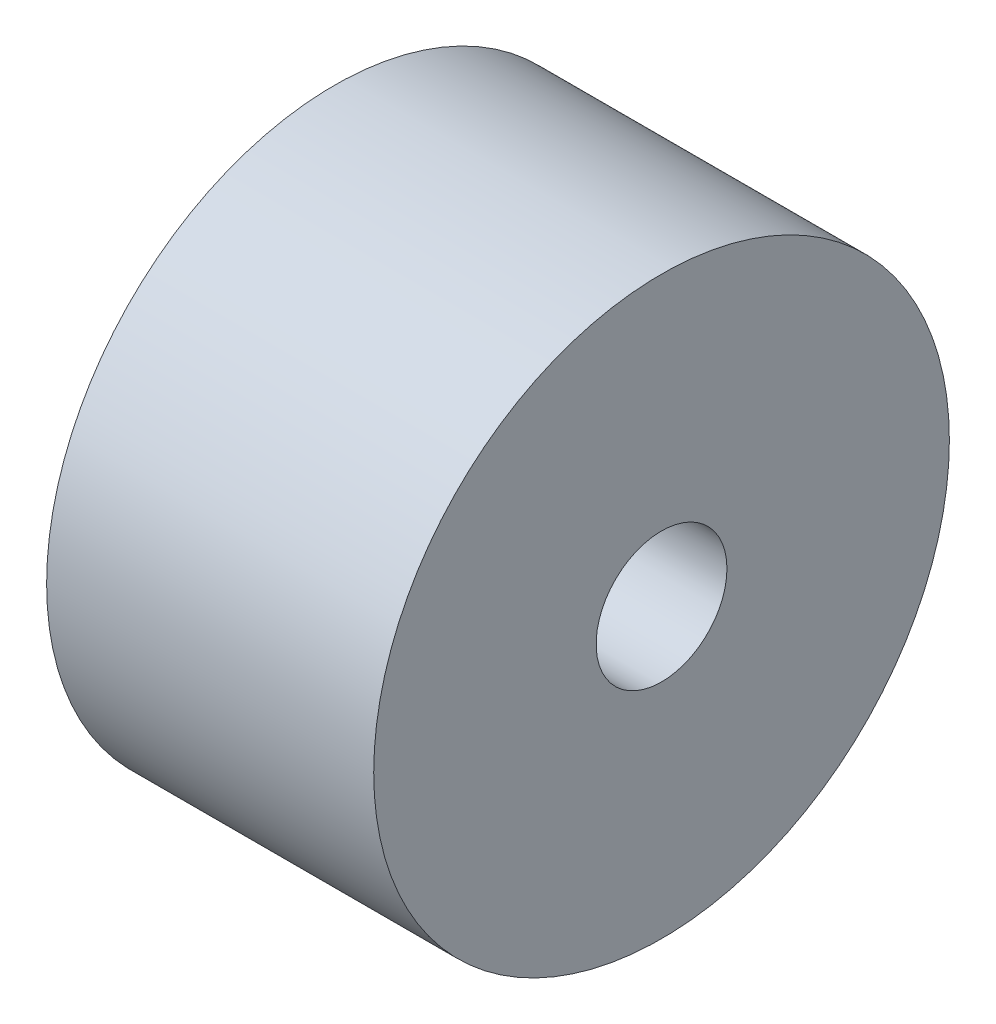
from build123d import *

# Parameters (mm, degrees)
SKETCH_1_R      = 4.4
SKETCH_1_R_2    = 1
EXTRUDE_1_DEPTH = 5


with BuildPart() as part:
    # Эскиз1 → Бобышка-Вытянуть1 (new body)
    with BuildSketch(Plane(origin=(0, 0, 0), x_dir=(0, 0, -1), z_dir=(1, 0, 0))):
        Circle(SKETCH_1_R)
        Circle(SKETCH_1_R_2, mode=Mode.SUBTRACT)
    extrude(amount=EXTRUDE_1_DEPTH)


solid = part.part
